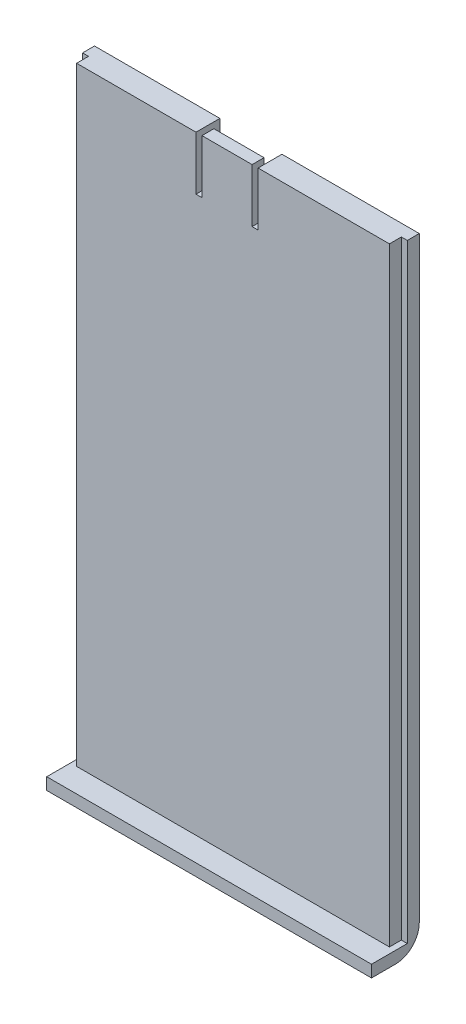
from build123d import *

# Parameters (mm, degrees)
SKETCH1_W           = 27.2
SKETCH1_H           = 52
BOSS_EXTRUDE1_DEPTH = 2
SKETCH2_W           = 0.5
SKETCH2_H           = 52
CUT_EXTRUDE1_DEPTH  = 1
SKETCH3_W           = 0.5
SKETCH3_H           = 52
CUT_EXTRUDE2_DEPTH  = 1
SKETCH4_W           = 0.5
SKETCH4_H           = 2
CUT_EXTRUDE3_DEPTH  = 4.5
SKETCH5_W           = 0.5
SKETCH5_H           = 2
CUT_EXTRUDE4_DEPTH  = 4.5
SKETCH6_W           = 4.2
SKETCH6_H           = 1
CUT_EXTRUDE5_DEPTH  = 4.5
SKETCH9_W           = 27.2
SKETCH9_H           = 1
BOSS_EXTRUDE3_DEPTH = 4
FILLET1_R           = 2


with BuildPart() as part:
    # Sketch1 → Boss-Extrude1 (new body)
    with BuildSketch(Plane.XY):
        with Locations((13.6, 26)):
            Rectangle(SKETCH1_W, SKETCH1_H)
    extrude(amount=BOSS_EXTRUDE1_DEPTH)

    # Sketch2 → Cut-Extrude1 (cut)
    with BuildSketch(Plane.XY.offset(2)):
        with Locations((0.25, 26)):
            Rectangle(SKETCH2_W, SKETCH2_H)
    extrude(amount=-CUT_EXTRUDE1_DEPTH, mode=Mode.SUBTRACT)

    # Sketch3 → Cut-Extrude2 (cut)
    with BuildSketch(Plane.XY.offset(2)):
        with Locations((26.95, 26)):
            Rectangle(SKETCH3_W, SKETCH3_H)
    extrude(amount=-CUT_EXTRUDE2_DEPTH, mode=Mode.SUBTRACT)

    # Sketch4 → Cut-Extrude3 (cut)
    with BuildSketch(Plane(origin=(0, 52, 0), x_dir=(1, 0, 0), z_dir=(0, 1, 0))):
        with Locations((10.75, -1)):
            Rectangle(SKETCH4_W, SKETCH4_H)
    extrude(amount=-CUT_EXTRUDE3_DEPTH, mode=Mode.SUBTRACT)

    # Sketch5 → Cut-Extrude4 (cut)
    with BuildSketch(Plane(origin=(0, 52, 0), x_dir=(1, 0, 0), z_dir=(0, 1, 0))):
        with Locations((15.45, -1)):
            Rectangle(SKETCH5_W, SKETCH5_H)
    extrude(amount=-CUT_EXTRUDE4_DEPTH, mode=Mode.SUBTRACT)

    # Sketch6 → Cut-Extrude5 (cut)
    with BuildSketch(Plane(origin=(0, 52, 0), x_dir=(1, 0, 0), z_dir=(0, 1, 0))):
        with Locations((13.1, -0.5)):
            Rectangle(SKETCH6_W, SKETCH6_H)
    extrude(amount=-CUT_EXTRUDE5_DEPTH, mode=Mode.SUBTRACT)

    # Sketch9 → Boss-Extrude3 (add)
    with BuildSketch(Plane(origin=(0, 0, 0), x_dir=(-1, 0, 0), z_dir=(0, 0, -1))):
        with Locations((-13.6, 0.5)):
            Rectangle(SKETCH9_W, SKETCH9_H)
    extrude(amount=-BOSS_EXTRUDE3_DEPTH)

    # Fillet1
    fillet1_edges = [part.edges().sort_by_distance(p)[0] for p in [
        (13.6, 0, 0),
    ]]
    fillet(fillet1_edges, radius=FILLET1_R)


solid = part.part
